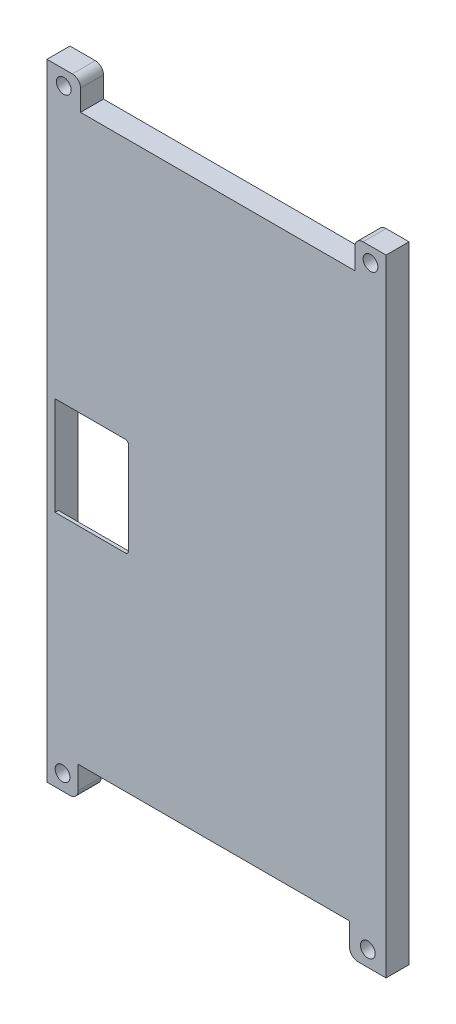
from build123d import *

# Parameters (mm, degrees)
IZIM1_W                     = 172.5
IZIM1_H                     = 103.4
IZIM1_W_2                   = 165
IZIM1_H_2                   = 98.4
Y_KSEKLIK_EKSTR_ZYON1_DEPTH = 6
Y_KSEKLIK_EKSTR_ZYON2_DEPTH = 1
IZIM3_R                     = 2.25
Y_KSEKLIK_EKSTR_ZYON3_DEPTH = 7


with BuildPart() as part:
    # Çizim1 → Yükseklik-Ekstrüzyon1 (new body)
    with BuildSketch(Plane(origin=(0, 0, 0), x_dir=(0, 1, 0), z_dir=(0, 0, 1))):
        with Locations((47.811428221, -21.27957211)):
            Rectangle(IZIM1_W, IZIM1_H)
        with Locations((46.561428221, -21.27957211)):
            Rectangle(IZIM1_W_2, IZIM1_H_2, mode=Mode.SUBTRACT)
    extrude(amount=Y_KSEKLIK_EKSTR_ZYON1_DEPTH)

    # Çizim2 → Yükseklik-Ekstrüzyon2 (add)
    with BuildSketch(Plane.XY.offset(6)):
        Polygon((-30.42042789, 54.561428221), (-30.42042789, 134.061428221), (72.97957211, 134.061428221), (72.97957211, -38.438571779), (-30.42042789, -38.438571779), (-30.42042789, 24.561428221), align=None)
        with BuildLine():
            Line((-27.92042789, 24.561428221), (-6.52042789, 24.561428221))
            ThreePointArc((-6.52042789, 24.561428221), (-5.813321109, 24.85432144), (-5.52042789, 25.561428221))
            Line((-5.52042789, 25.561428221), (-5.52042789, 53.561428221))
            ThreePointArc((-5.52042789, 53.561428221), (-5.813321109, 54.268535002), (-6.52042789, 54.561428221))
            Line((-6.52042789, 54.561428221), (-27.92042789, 54.561428221))
            Line((-27.92042789, 54.561428221), (-27.92042789, 24.561428221))
        make_face(mode=Mode.SUBTRACT)
    extrude(amount=Y_KSEKLIK_EKSTR_ZYON2_DEPTH)

    # Çizim3 → Yükseklik-Ekstrüzyon3 (add)
    # profile 1 of 4: a face of its own
    with BuildSketch(Plane(origin=(0, 0, 0), x_dir=(0, 1, 0), z_dir=(0, 0, 1))):
        with BuildLine():
            Line((-38.438571779, 30.42042789), (-47.938571779, 30.42042789))
            Line((-47.938571779, 30.42042789), (-47.938571779, 23.42042789))
            ThreePointArc((-47.938571779, 23.42042789), (-47.206338732, 21.652660937), (-45.438571779, 20.92042789))
            Line((-45.438571779, 20.92042789), (-38.438571779, 20.92042789))
            Line((-38.438571779, 20.92042789), (-38.438571779, 30.42042789))
        make_face()
        with Locations(Location((-43.188571779, 25.67042789, 0), (0, 0, 90))):
            Circle(IZIM3_R, mode=Mode.SUBTRACT)
    # profile 2 of 4: a face of its own
    with BuildSketch(Plane(origin=(0, 0, 0), x_dir=(0, 1, 0), z_dir=(0, 0, 1))):
        with BuildLine():
            Line((-38.438571779, -61.85378906), (-45.438571779, -61.85378906))
            ThreePointArc((-45.438571779, -61.85378906), (-47.206338732, -62.586022107), (-47.938571779, -64.35378906))
            Line((-47.938571779, -64.35378906), (-47.938571779, -72.97957211))
            Line((-47.938571779, -72.97957211), (-38.438571779, -72.97957211))
            Line((-38.438571779, -72.97957211), (-38.438571779, -61.85378906))
        make_face()
        with Locations(Location((-43.188571779, -67.416680585, 0), (0, 0, 90))):
            Circle(IZIM3_R, mode=Mode.SUBTRACT)
    # profile 3 of 4: a face of its own
    with BuildSketch(Plane(origin=(0, 0, 0), x_dir=(0, 1, 0), z_dir=(0, 0, 1))):
        with BuildLine():
            Line((142.961428221, 30.42042789), (134.061428221, 30.42042789))
            Line((134.061428221, 30.42042789), (134.061428221, 20.186573321))
            Line((134.061428221, 20.186573321), (140.461428221, 20.186573321))
            ThreePointArc((140.461428221, 20.186573321), (142.229195174, 20.918806368), (142.961428221, 22.686573321))
            Line((142.961428221, 22.686573321), (142.961428221, 30.42042789))
        make_face()
        with Locations(Location((138.511428221, 25.303500605, 0), (0, 0, 90))):
            Circle(IZIM3_R, mode=Mode.SUBTRACT)
    # profile 4 of 4: a face of its own
    with BuildSketch(Plane(origin=(0, 0, 0), x_dir=(0, 1, 0), z_dir=(0, 0, 1))):
        with BuildLine():
            Line((140.461428221, -63.47957211), (134.061428221, -63.47957211))
            Line((134.061428221, -63.47957211), (134.061428221, -72.97957211))
            Line((134.061428221, -72.97957211), (142.961428221, -72.97957211))
            Line((142.961428221, -72.97957211), (142.961428221, -65.97957211))
            ThreePointArc((142.961428221, -65.97957211), (142.229195174, -64.211805157), (140.461428221, -63.47957211))
        make_face()
        with Locations(Location((138.511428221, -68.22957211, 0), (0, 0, 90))):
            Circle(IZIM3_R, mode=Mode.SUBTRACT)
    extrude(amount=Y_KSEKLIK_EKSTR_ZYON3_DEPTH)


solid = part.part
